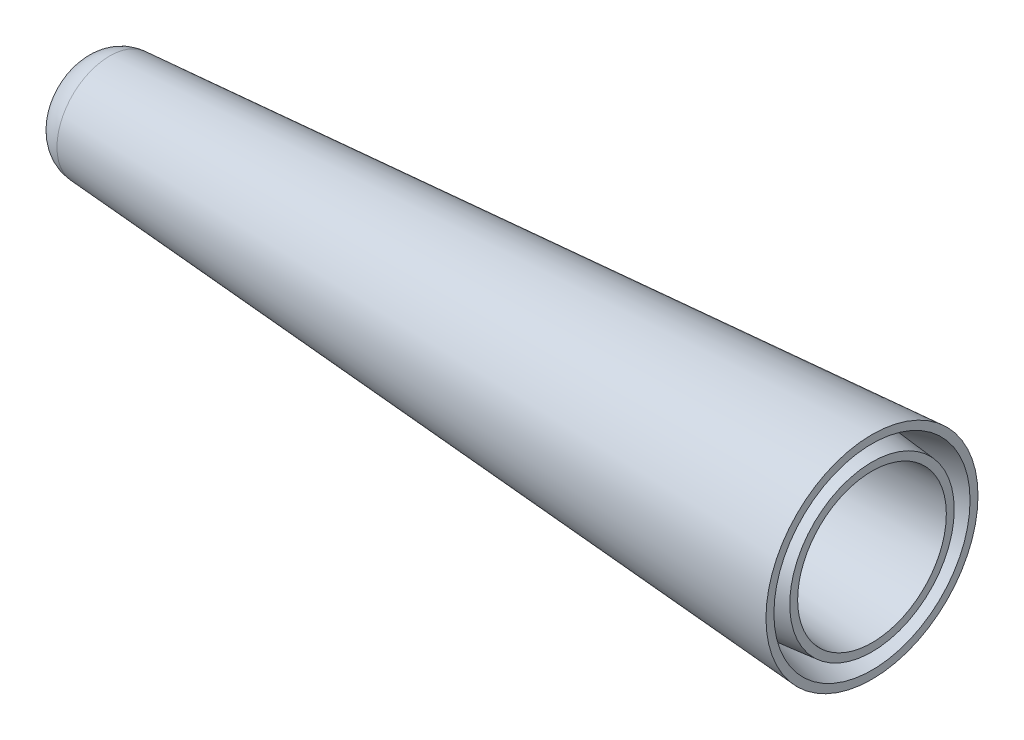
from build123d import *


with BuildPart() as part:
    # Sketch2 → Revolve2 (revolve)
    with BuildSketch(Plane.XY, mode=Mode.PRIVATE) as revolve2_sk:
        with BuildLine():
            Line((0, 1.2), (50, 4.696340597))
            Line((50, 4.696340597), (50, 6.696340597))
            Line((50, 6.696340597), (1.851094968, 3.32944117))
            ThreePointArc((1.851094968, 3.32944117), (0.484525778, 2.648094905), (0, 1.2))
        make_face()
    revolve(revolve2_sk.sketch.rotate(Axis((-19.275847123, 0, 0), (1, 0, 0)), 90), axis=Axis((-19.275847123, 0, 0), (1, 0, 0)))

    # Sketch3 → Revolve3 (revolve)
    with BuildSketch(Plane.XY, mode=Mode.PRIVATE) as revolve3_sk:
        Polygon((50, 4.695121509), (180, 9.234821543), (180, 11.236040631), (50, 6.696340597), align=None)
    revolve(revolve3_sk.sketch.rotate(Axis((50, 0, 0), (-1, 0, 0)), 90), axis=Axis((50, 0, 0), (-1, 0, 0)))

    # SurfaceCut3
    split(bisect_by=Plane(origin=(50, 0, 0), x_dir=(0, 0, -1), z_dir=(1, 0, 0)), keep=Keep.BOTTOM)

    # Sketch4 → Cut-Revolve1 (revolve, cut)
    with BuildSketch(Plane.XY, mode=Mode.PRIVATE) as cut_revolve1_sk:
        Polygon((50, 6.195119648), (47, 5.484118263), (50, 5.196340597), align=None)
    revolve(cut_revolve1_sk.sketch.rotate(Axis((50, 0, 0), (-1, 0, 0)), 90), axis=Axis((50, 0, 0), (-1, 0, 0)), mode=Mode.SUBTRACT)


solid = part.part
